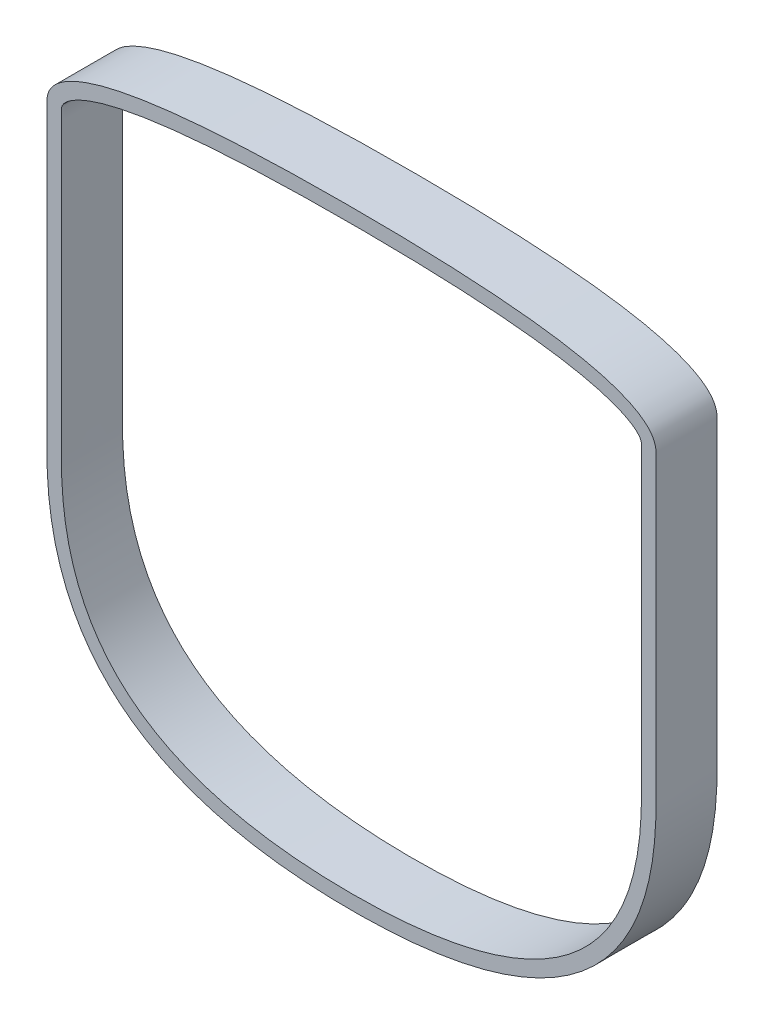
from build123d import *

# Parameters (mm, degrees)
BOSS_EXTRUDE1_DEPTH = 10
CUT_EXTRUDE1_DEPTH  = 20


with BuildPart() as part:
    # Sketch1 → Boss-Extrude1 (new, symmetric)
    with BuildSketch(Plane.XY):
        with BuildLine():
            add(Edge.make_bspline(
                [(91.421047962, -59.551695851), (93.107261833, -56.236393803), (94.480548478, -52.832383307), (96.712751173, -45.878548809), (97.571262419, -42.328610053), (98.53424392, -36.911631932), (98.801208165, -35.090656279), (99.126152214, -32.337789442), (99.221805024, -31.416825619), (99.388257894, -29.577044248), (99.459202655, -28.657077294), (99.637540415, -25.896962215), (99.710458171, -24.056600001), (99.757583219, -21.295670106), (99.760849262, -20.375282875), (99.760049572, -18.534462885), (99.76, -17.614055065), (99.76, -1.967127359), (99.76, 27.485913029), (99.76, 58.779768441), (99.76, 75.807307416), (99.76, 78.338428074), (99.76, 79.028733708), (99.76, 79.488937464), (99.761413436, 79.719041333), (99.757883569, 80.179240117), (99.747934724, 80.410112499), (99.704744307, 80.866017836), (99.67285945, 81.091572237), (99.545981925, 81.76095813), (99.419360209, 82.197417659), (99.169689828, 82.838183523), (99.07636992, 83.049310163), (98.873793771, 83.459245016), (98.7643114, 83.659184697), (98.413076538, 84.245021933), (98.148691301, 84.617032792), (97.279004652, 85.686108534), (96.622038811, 86.312440594), (95.564269992, 87.167360685), (95.199152947, 87.43796139), (94.448916717, 87.956214455), (94.063771502, 88.203513495), (92.897443626, 88.907414167), (92.100077091, 89.329753182), (90.47860299, 90.111098881), (89.654049879, 90.469050359), (87.985229407, 91.138262916), (87.140587703, 91.44863742), (84.582191426, 92.321804458), (82.840329425, 92.83094604), (79.349049024, 93.74122969), (77.596760744, 94.143076373), (74.082782472, 94.871399783), (72.321089676, 95.197854023), (67.025365609, 96.091874373), (63.480945073, 96.576153674), (56.374076568, 97.400193179), (52.811687125, 97.740422556), (45.673910284, 98.316681627), (42.098671976, 98.553906518), (34.938257625, 98.948689245), (31.351715603, 99.105873484), (20.596602811, 99.485145146), (13.428346046, 99.615835048), (-0.905675789, 99.709828522), (-8.071552528, 99.680633836), (-22.400498817, 99.433664001), (-29.563549024, 99.214589511), (-40.304785874, 98.661707732), (-43.884637219, 98.43973129), (-51.042855781, 97.896078133), (-54.623016512, 97.573915842), (-61.756136337, 96.793947769), (-65.311434696, 96.335895362), (-70.618855541, 95.494525403), (-72.383638991, 95.187734691), (-75.902028409, 94.506593055), (-77.655561129, 94.131799403), (-80.274386521, 93.500258343), (-81.145379719, 93.27796671), (-82.882598204, 92.804564693), (-83.750111494, 92.55312547), (-86.332742955, 91.750734613), (-88.027315764, 91.151142356), (-90.504418217, 90.097697069), (-91.318871111, 89.719789731), (-92.518182533, 89.09971525), (-92.914162386, 88.884005834), (-93.696646193, 88.430043759), (-94.084181778, 88.19107062), (-95.218997958, 87.441385438), (-95.940925417, 86.898535151), (-96.94267788, 85.98333009), (-97.264342459, 85.659682736), (-97.867074682, 84.977919009), (-98.146002617, 84.621634696), (-98.649708166, 83.871895158), (-98.874844859, 83.478050507), (-99.258516559, 82.647223817), (-99.411307039, 82.222359891), (-99.637277045, 81.353362927), (-99.709534542, 80.909006719), (-99.757345178, 80.227810626), (-99.76, 79.998070007), (-99.76, 79.540199975), (-99.76, 77.479784832), (-99.76, 71.756409435), (-99.76, 58.936048546), (-99.76, 33.295326767), (-99.76, 7.654604988), (-99.76, -12.49167641), (-99.76, -17.986116791), (-99.76, -20.733336982), (-99.753636682, -21.648761023), (-99.717250835, -23.478434118), (-99.688705526, -24.392756535), (-99.491907985, -28.961683285), (-99.162522502, -32.60828525), (-98.073369956, -39.880115115), (-97.314732981, -43.505399139), (-96.017765599, -48.019688094), (-95.740097809, -48.923823975), (-95.152750381, -50.713460678), (-94.842792261, -51.600183095), (-93.862651732, -54.235360076), (-93.142187768, -55.958816725), (-90.768999623, -61.023890304), (-88.905136354, -64.260537582), (-86.179182191, -68.109409619), (-85.613656429, -68.869873246), (-84.454909695, -70.35439219), (-83.860296727, -71.080572702), (-82.031646619, -73.211834952), (-80.752811797, -74.569651664), (-76.743836262, -78.461131471), (-73.840325287, -80.811875514), (-69.944442761, -83.469133967), (-69.153035753, -83.985562057), (-67.558640405, -84.98235619), (-66.753959093, -85.463832811), (-64.318613744, -86.86010037), (-62.666654591, -87.726743226), (-57.634514007, -90.154241518), (-54.178666825, -91.544017335), (-48.870476166, -93.347368754), (-47.080191797, -93.901259473), (-43.461102704, -94.921946717), (-41.641379388, -95.385998293), (-36.176030419, -96.651393989), (-32.515023689, -97.330691024), (-25.164756783, -98.42312431), (-21.475459209, -98.835908242), (-14.0739188, -99.445320945), (-10.3616566, -99.641767267), (-2.917531143, -99.850008724), (0.81398247, -99.865097668), (8.295173485, -99.724164075), (12.022638011, -99.563559417), (23.158227691, -98.76588114), (30.520958379, -97.820364098), (41.429038047, -95.479495674), (45.042115693, -94.54354478), (49.521582664, -93.123450195), (50.414766344, -92.827068036), (52.18740038, -92.211110388), (53.067970096, -91.891200371), (55.691759814, -90.894270228), (57.417073323, -90.180076866), (62.5140793, -87.873631492), (65.806901599, -86.11764784), (69.762284028, -83.589174108), (70.54622459, -83.066031864), (72.092914523, -81.987219399), (72.852173123, -81.434055027), (75.087205623, -79.732814576), (76.520305694, -78.543059014), (80.642644213, -74.800954029), (83.156121824, -72.076939184), (85.987963595, -68.369138839), (86.538905279, -67.612511558), (87.609442704, -66.068641446), (88.130013313, -65.279857678), (89.133857725, -63.679768899), (89.616945466, -62.868898151), (90.313972558, -61.636724502), (90.655602034, -61.016680602), (91.042265207, -60.286453124), (91.205442729, -59.972041177), (91.313666119, -59.762110382), (91.368353778, -59.655299041), (91.421047962, -59.551695851)],
                knots=[0, 0, 0, 0, 0.015625, 0.015625, 0.03125, 0.03125, 0.0390625, 0.0390625, 0.04296875, 0.04296875, 0.046875, 0.046875, 0.0546875, 0.0546875, 0.05859375, 0.05859375, 0.0625, 0.0625, 0.125, 0.1875, 0.1953125, 0.197265625, 0.198242187, 0.198242187, 0.19921875, 0.19921875, 0.200195312, 0.200195312, 0.201171875, 0.201171875, 0.203125, 0.203125, 0.204101562, 0.204101562, 0.205078125, 0.205078125, 0.20703125, 0.20703125, 0.2109375, 0.2109375, 0.212890625, 0.212890625, 0.21484375, 0.21484375, 0.21875, 0.21875, 0.22265625, 0.22265625, 0.2265625, 0.2265625, 0.234375, 0.234375, 0.2421875, 0.2421875, 0.25, 0.25, 0.265625, 0.265625, 0.28125, 0.28125, 0.296875, 0.296875, 0.3125, 0.3125, 0.34375, 0.34375, 0.375, 0.375, 0.40625, 0.40625, 0.421875, 0.421875, 0.4375, 0.4375, 0.453125, 0.453125, 0.4609375, 0.4609375, 0.46875, 0.46875, 0.47265625, 0.47265625, 0.4765625, 0.4765625, 0.484375, 0.484375, 0.48828125, 0.48828125, 0.490234375, 0.490234375, 0.4921875, 0.4921875, 0.49609375, 0.49609375, 0.498046875, 0.498046875, 0.5, 0.5, 0.501953125, 0.501953125, 0.50390625, 0.50390625, 0.505859375, 0.505859375, 0.506835937, 0.506835937, 0.5078125, 0.515625, 0.53125, 0.5625, 0.625, 0.640625, 0.6484375, 0.6484375, 0.65234375, 0.65234375, 0.65625, 0.65625, 0.671875, 0.671875, 0.6875, 0.6875, 0.69140625, 0.69140625, 0.6953125, 0.6953125, 0.703125, 0.703125, 0.71875, 0.71875, 0.72265625, 0.72265625, 0.7265625, 0.7265625, 0.734375, 0.734375, 0.75, 0.75, 0.75390625, 0.75390625, 0.7578125, 0.7578125, 0.765625, 0.765625, 0.78125, 0.78125, 0.7890625, 0.7890625, 0.796875, 0.796875, 0.8125, 0.8125, 0.828125, 0.828125, 0.84375, 0.84375, 0.859375, 0.859375, 0.875, 0.875, 0.90625, 0.90625, 0.921875, 0.921875, 0.92578125, 0.92578125, 0.9296875, 0.9296875, 0.9375, 0.9375, 0.953125, 0.953125, 0.95703125, 0.95703125, 0.9609375, 0.9609375, 0.96875, 0.96875, 0.984375, 0.984375, 0.98828125, 0.98828125, 0.9921875, 0.9921875, 0.99609375, 0.99609375, 0.998046875, 0.999023438, 0.999511719, 0.999511719, 1, 1, 1, 1], degree=3))
        make_face()
    extrude(amount=BOSS_EXTRUDE1_DEPTH, both=True)

    # Sketch2 → Cut-Extrude1 (cut)
    with BuildSketch(Plane.XY.offset(10)):
        with BuildLine():
            add(Edge.make_bspline(
                [(-94.446756596, 81.592255875), (-94.56995442, 81.408882315), (-94.678797504, 81.218571225), (-94.855565254, 80.818173503), (-94.923565186, 80.604588929), (-94.97956235, 80.281217773), (-94.991844831, 80.172813228), (-95.000350255, 79.954458978), (-95, 79.844838981), (-95, 79.51608009), (-95, 78.420217118), (-95, 75.570973392), (-95, 69.43414075), (-95, 57.160475467), (-95, 32.613144901), (-95, 8.065814334), (-95, -11.221373968), (-95, -16.481516232), (-95, -19.111587364), (-95.002415547, -19.988279748), (-94.991240191, -21.74165122), (-94.976665842, -22.618329492), (-94.900953404, -25.248337735), (-94.81040021, -26.997531021), (-94.541505323, -30.478749231), (-94.362930585, -32.21192683), (-93.681611074, -37.386939831), (-93.035622524, -40.804651458), (-91.926015254, -45.025910504), (-91.68902914, -45.867625264), (-91.183039767, -47.545662757), (-90.913655588, -48.383225613), (-90.057028705, -50.878734693), (-89.424812805, -52.51018732), (-87.334670049, -57.302560989), (-85.684187919, -60.361993142), (-83.261545966, -63.996783239), (-82.759024925, -64.714257986), (-81.717114895, -66.129775725), (-81.176662871, -66.82900369), (-79.516257152, -68.875236033), (-78.352940917, -70.177619869), (-74.701446431, -73.907775721), (-72.051226257, -76.158008487), (-68.492964328, -78.701834932), (-67.769057484, -79.197173775), (-66.297225622, -80.16153624), (-65.552144235, -80.628730576), (-63.299968149, -81.98184132), (-61.772053747, -82.821886065), (-57.117648482, -85.176393178), (-53.921341938, -86.527212274), (-49.013711685, -88.28817701), (-47.358988073, -88.830989476), (-44.850839481, -89.584117848), (-44.010451054, -89.824990557), (-42.321341118, -90.287203788), (-41.472619982, -90.50852482), (-37.229443219, -91.563999214), (-33.819859262, -92.251908026), (-26.976716436, -93.378341588), (-23.543121115, -93.816487174), (-16.656305985, -94.488646841), (-13.203185415, -94.7236932), (-6.280451906, -95.022234348), (-2.810968314, -95.087074589), (2.404072924, -95.071829815), (4.144216479, -95.048061509), (7.628362972, -94.960380066), (9.369769973, -94.896013286), (14.580858595, -94.636647183), (18.04183148, -94.37630389), (24.932719862, -93.648114157), (28.362425247, -93.178863898), (35.183671763, -91.985377257), (38.575610988, -91.263800649), (43.627799486, -89.942778104), (45.305904278, -89.46220775), (48.648314156, -88.410559008), (50.300021112, -87.843183064), (55.191593494, -86.005628935), (58.368555629, -84.601399414), (62.977698333, -82.161967774), (64.487888453, -81.293009496), (66.70961611, -79.896747932), (67.444052644, -79.415046815), (68.892230087, -78.422285097), (69.603858369, -77.912742905), (73.098624766, -75.298092119), (75.691328191, -72.991836976), (79.248552033, -69.181957617), (80.379028921, -67.853624843), (81.988514309, -65.770045345), (82.510784405, -65.060010088), (83.515771113, -63.624885966), (83.999951324, -62.897954135), (86.331572886, -59.217615861), (87.911102358, -56.127134498), (89.568597991, -52.101885212), (89.88415822, -51.288680348), (90.484345875, -49.646444105), (90.769308022, -48.816364591), (91.577130336, -46.310191607), (92.049391835, -44.629712109), (93.289532175, -39.562431209), (93.882628493, -36.150059749), (94.695619937, -29.270718832), (94.91448521, -25.80359871), (94.995594544, -21.441540556), (95.000177825, -20.567185411), (95.000752589, -18.818705198), (95.000021677, -17.944465069), (94.999967229, -15.321744729), (95, -13.573264504), (95, -8.327823827), (95, 2.163057527), (95, 26.641780687), (95, 51.120503847), (95, 70.353786329), (95, 76.036347063), (95, 78.221947345), (95, 78.87762743), (94.999846059, 79.09618309), (95.000201354, 79.533313228), (95.003397535, 79.751963946), (94.994588158, 80.188834041), (94.968065293, 80.406641496), (94.878726919, 80.731946606), (94.840944783, 80.841253072), (94.753546369, 81.053801767), (94.704247496, 81.156487451), (94.542863599, 81.455900896), (94.417560023, 81.644157271), (94.142981615, 82.005307537), (93.993024323, 82.179212802), (93.524301051, 82.67587294), (93.186212549, 82.97411475), (92.48057665, 83.532788758), (92.112386957, 83.792396589), (91.354923647, 84.284551663), (90.964271153, 84.517343271), (90.174945813, 84.956264287), (89.775403114, 85.162878647), (88.565855323, 85.753976817), (87.74477028, 86.109293857), (86.083221322, 86.768915155), (85.242257262, 87.071902836), (83.54535015, 87.638447623), (82.689484298, 87.902207952), (80.965913452, 88.398563351), (80.097098306, 88.631483024), (77.48595516, 89.290659551), (75.739556882, 89.676618742), (72.239107412, 90.375904914), (70.48496341, 90.688351058), (66.970979231, 91.259182115), (65.211093692, 91.517136514), (59.924424658, 92.224446333), (56.3909448, 92.610247951), (49.311834405, 93.266531612), (45.766112885, 93.536150154), (38.665679277, 93.990059634), (35.11086726, 94.173402156), (27.994089797, 94.472195502), (24.431295481, 94.588377719), (17.304740653, 94.76697626), (13.741446237, 94.828917156), (6.614829359, 94.907674009), (3.051507463, 94.925398891), (-4.075160104, 94.922595293), (-7.638506534, 94.900843032), (-18.328588009, 94.76771278), (-25.457449307, 94.592304326), (-36.137858268, 94.121638099), (-39.696138756, 93.93082696), (-46.807791504, 93.459488119), (-50.362364759, 93.179517467), (-57.459170084, 92.496914463), (-61.000155815, 92.096498455), (-66.294510356, 91.359392109), (-68.056453389, 91.091040139), (-71.573044616, 90.496194799), (-73.325832789, 90.170041308), (-76.81371358, 89.440972884), (-78.549293263, 89.038509976), (-81.134313205, 88.351572022), (-81.993676275, 88.10814497), (-83.697257413, 87.589192101), (-84.54217531, 87.313659238), (-86.213307163, 86.718896026), (-87.039539326, 86.399708213), (-88.667912727, 85.705049642), (-89.469700328, 85.328752692), (-90.644728189, 84.699701088), (-91.031569446, 84.478722055), (-91.79237666, 84.006683792), (-92.168215945, 83.755220403), (-92.894628836, 83.215118409), (-93.241913396, 82.928620453), (-93.727077326, 82.461931212), (-93.88282839, 82.300200998), (-94.104765277, 82.045530464), (-94.176733082, 81.958562804), (-94.280988011, 81.824292624), (-94.315121574, 81.778897434), (-94.382012018, 81.686684971), (-94.41595714, 81.638099266), (-94.446756596, 81.592255875)],
                knots=[0, 0, 0, 0, 0.000976563, 0.000976563, 0.001953125, 0.001953125, 0.002441406, 0.002441406, 0.002929688, 0.002929688, 0.00390625, 0.0078125, 0.015625, 0.03125, 0.0625, 0.125, 0.140625, 0.1484375, 0.1484375, 0.15234375, 0.15234375, 0.15625, 0.15625, 0.1640625, 0.1640625, 0.171875, 0.171875, 0.1875, 0.1875, 0.19140625, 0.19140625, 0.1953125, 0.1953125, 0.203125, 0.203125, 0.21875, 0.21875, 0.22265625, 0.22265625, 0.2265625, 0.2265625, 0.234375, 0.234375, 0.25, 0.25, 0.25390625, 0.25390625, 0.2578125, 0.2578125, 0.265625, 0.265625, 0.28125, 0.28125, 0.2890625, 0.2890625, 0.29296875, 0.29296875, 0.296875, 0.296875, 0.3125, 0.3125, 0.328125, 0.328125, 0.34375, 0.34375, 0.359375, 0.359375, 0.3671875, 0.3671875, 0.375, 0.375, 0.390625, 0.390625, 0.40625, 0.40625, 0.421875, 0.421875, 0.4296875, 0.4296875, 0.4375, 0.4375, 0.453125, 0.453125, 0.4609375, 0.4609375, 0.46484375, 0.46484375, 0.46875, 0.46875, 0.484375, 0.484375, 0.4921875, 0.4921875, 0.49609375, 0.49609375, 0.5, 0.5, 0.515625, 0.515625, 0.51953125, 0.51953125, 0.5234375, 0.5234375, 0.53125, 0.53125, 0.546875, 0.546875, 0.5625, 0.5625, 0.56640625, 0.56640625, 0.5703125, 0.5703125, 0.578125, 0.578125, 0.59375, 0.625, 0.6875, 0.703125, 0.7109375, 0.712890625, 0.712890625, 0.713867188, 0.713867188, 0.71484375, 0.71484375, 0.715820313, 0.715820313, 0.716308594, 0.716308594, 0.716796875, 0.716796875, 0.717773438, 0.717773438, 0.71875, 0.71875, 0.720703125, 0.720703125, 0.72265625, 0.72265625, 0.724609375, 0.724609375, 0.7265625, 0.7265625, 0.73046875, 0.73046875, 0.734375, 0.734375, 0.73828125, 0.73828125, 0.7421875, 0.7421875, 0.75, 0.75, 0.7578125, 0.7578125, 0.765625, 0.765625, 0.78125, 0.78125, 0.796875, 0.796875, 0.8125, 0.8125, 0.828125, 0.828125, 0.84375, 0.84375, 0.859375, 0.859375, 0.875, 0.875, 0.90625, 0.90625, 0.921875, 0.921875, 0.9375, 0.9375, 0.953125, 0.953125, 0.9609375, 0.9609375, 0.96875, 0.96875, 0.9765625, 0.9765625, 0.98046875, 0.98046875, 0.984375, 0.984375, 0.98828125, 0.98828125, 0.9921875, 0.9921875, 0.994140625, 0.994140625, 0.99609375, 0.99609375, 0.998046875, 0.998046875, 0.999023438, 0.999023438, 0.999511719, 0.999511719, 0.999755859, 0.999755859, 1, 1, 1, 1], degree=3))
        make_face()
    extrude(amount=-CUT_EXTRUDE1_DEPTH, mode=Mode.SUBTRACT)


solid = part.part
